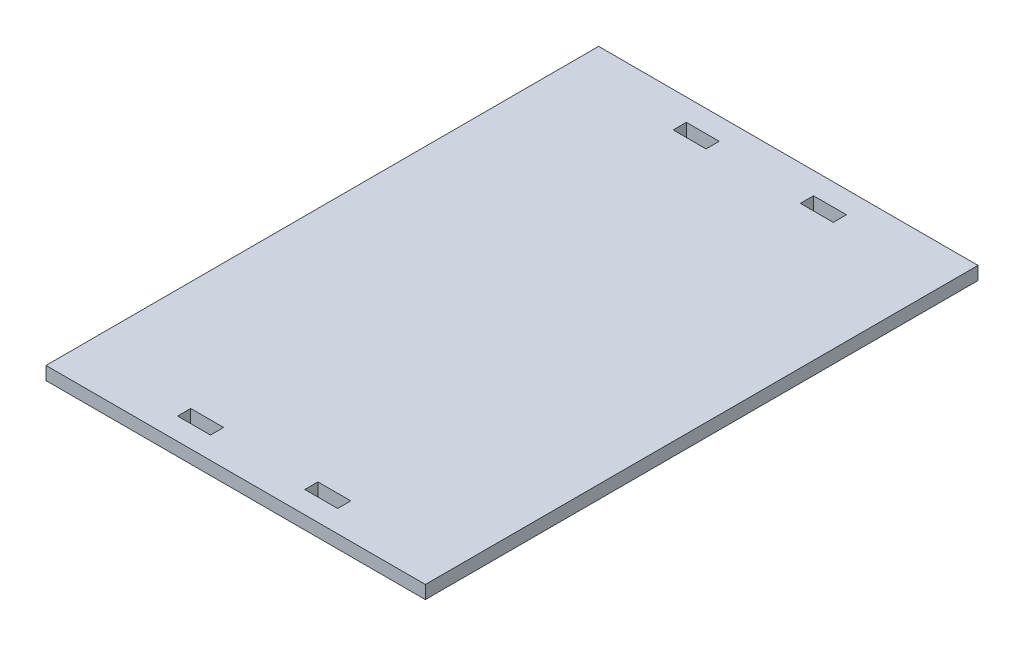
from build123d import *

# Parameters (mm, degrees)
SKETCH1_W           = 173
SKETCH1_H           = 252
SKETCH1_W_2         = 15
SKETCH1_H_2         = 6
BOSS_EXTRUDE1_DEPTH = 6


with BuildPart() as part:
    # Sketch1 → Boss-Extrude1 (new body)
    with BuildSketch(Plane(origin=(0, 0, 0), x_dir=(1, 0, 0), z_dir=(0, 1, 0))):
        with Locations((-86.5, -126)):
            Rectangle(SKETCH1_W, SKETCH1_H)
        with Locations((-115.5, -13)):
            Rectangle(SKETCH1_W_2, SKETCH1_H_2, mode=Mode.SUBTRACT)
        with Locations((-57.5, -13)):
            Rectangle(SKETCH1_W_2, SKETCH1_H_2, mode=Mode.SUBTRACT)
        with Locations((-115.5, -239)):
            Rectangle(SKETCH1_W_2, SKETCH1_H_2, mode=Mode.SUBTRACT)
        with Locations((-57.5, -239)):
            Rectangle(SKETCH1_W_2, SKETCH1_H_2, mode=Mode.SUBTRACT)
    extrude(amount=BOSS_EXTRUDE1_DEPTH)


solid = part.part
